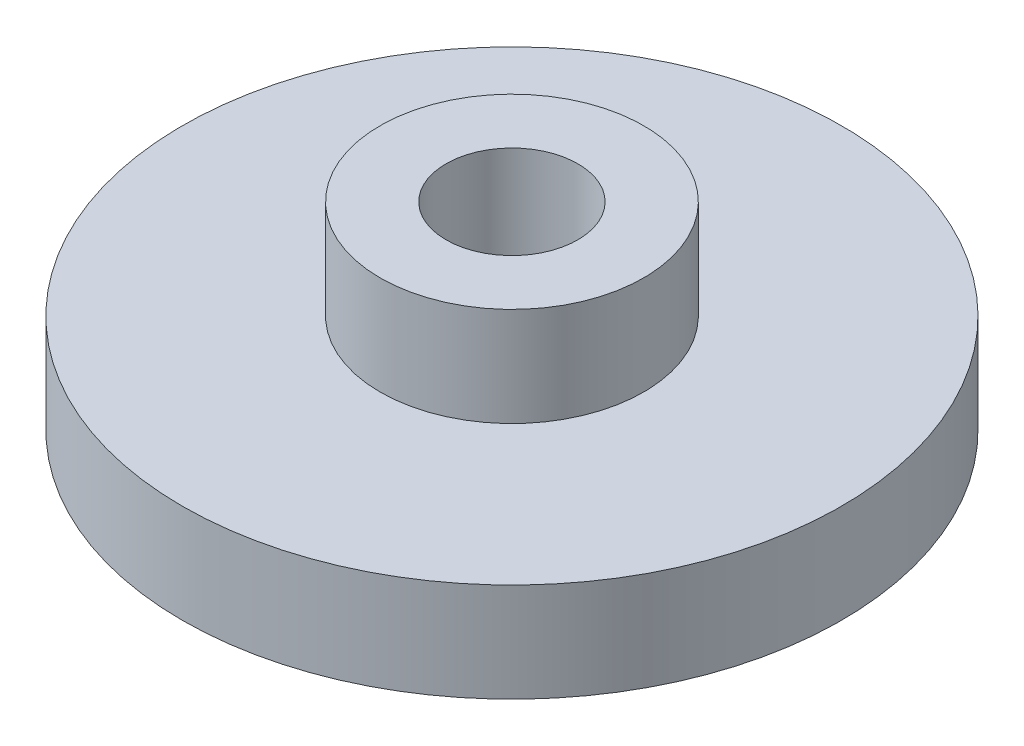
from build123d import *

# Parameters (mm, degrees)
SKETCH1_R           = 20
BOSS_EXTRUDE1_DEPTH = 6
SKETCH2_R           = 8
BOSS_EXTRUDE2_DEPTH = 6
SKETCH3_R           = 4
CUT_EXTRUDE1_DEPTH  = 31.724582991


with BuildPart() as part:
    # Sketch1 → Boss-Extrude1 (new body)
    with BuildSketch(Plane(origin=(0, 0, 0), x_dir=(1, 0, 0), z_dir=(0, 1, 0))):
        with Locations(Location((0, 0, 0), (0, 0, 270))):
            Circle(SKETCH1_R)
    extrude(amount=BOSS_EXTRUDE1_DEPTH)

    # Sketch2 → Boss-Extrude2 (add)
    with BuildSketch(Plane(origin=(0, 6, 0), x_dir=(1, 0, 0), z_dir=(0, 1, 0))):
        with Locations(Location((0, 0, 0), (0, 0, 270))):
            Circle(SKETCH2_R)
    extrude(amount=BOSS_EXTRUDE2_DEPTH)

    # Sketch3 → Cut-Extrude1 (cut, through all)
    with BuildSketch(Plane(origin=(0, 12, 0), x_dir=(1, 0, 0), z_dir=(0, 1, 0))):
        with Locations(Location((0, 0, 0), (0, 0, 270))):
            Circle(SKETCH3_R)
    extrude(amount=-CUT_EXTRUDE1_DEPTH, mode=Mode.SUBTRACT)


solid = part.part
